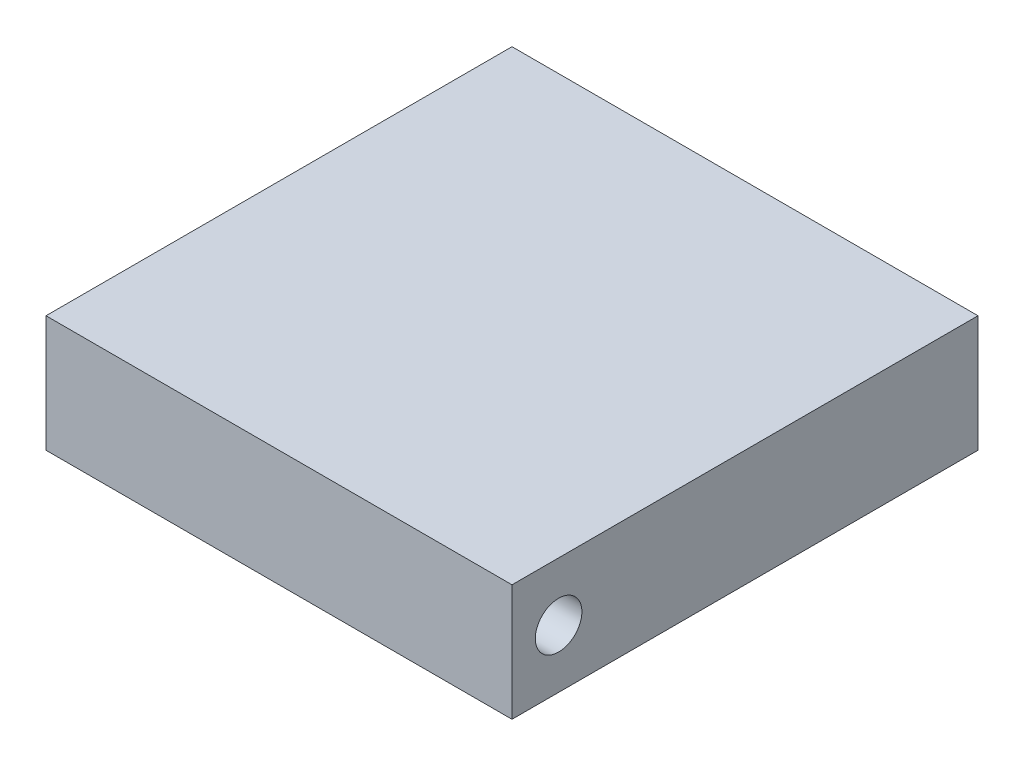
from build123d import *

# Parameters (mm, degrees)
SKETCH1_W           = 20
SKETCH1_H           = 20
BOSS_EXTRUDE1_DEPTH = 2.5
CUT_EXTRUDE1_REACH  = 24.5
SKETCH2_R           = 1


with BuildPart() as part:
    # Sketch1 → Boss-Extrude1 (new, symmetric)
    with BuildSketch(Plane(origin=(0, 0, 0), x_dir=(1, 0, 0), z_dir=(0, 1, 0))):
        Rectangle(SKETCH1_W, SKETCH1_H)
    extrude(amount=BOSS_EXTRUDE1_DEPTH, both=True)

    # Sketch2 → Cut-Extrude1 (cut, up to next)
    with BuildSketch(Plane(origin=(10, 0, 0), x_dir=(0, 0, -1), z_dir=(1, 0, 0)), mode=Mode.PRIVATE) as cut_extrude1_sk1:
        with Locations((-8, 0)):
            Circle(SKETCH2_R)
    cut_extrude1_tool1 = extrude(cut_extrude1_sk1.sketch, amount=-CUT_EXTRUDE1_REACH, mode=Mode.PRIVATE) & part.part
    add(cut_extrude1_tool1.solids().sort_by_distance((10, 0, 8))[0], mode=Mode.SUBTRACT)


solid = part.part
